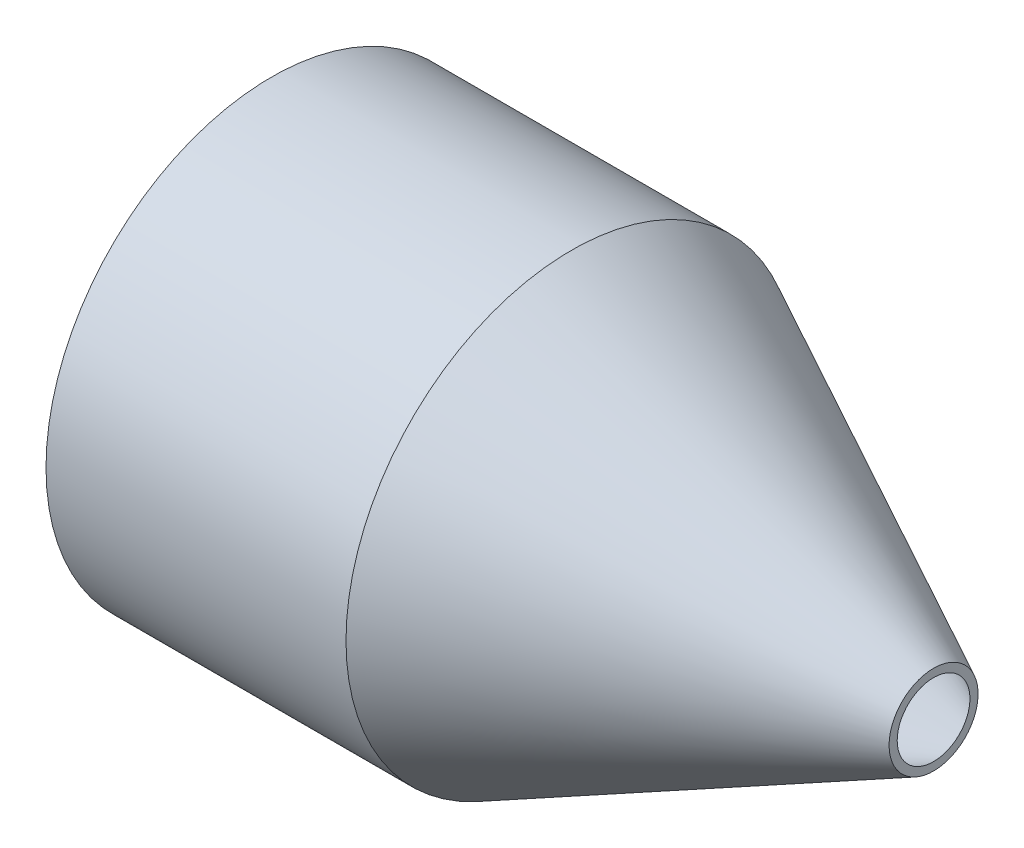
from build123d import *


with BuildPart() as part:
    # Эскиз1 → Повернуть1 (revolve)
    with BuildSketch(Plane.XY, mode=Mode.PRIVATE) as revolve_1_sk:
        Polygon((16.557430953, 300), (416.557430953, 300), (916.557430953, 50), (916.557430953, 61.180339887), (418.918110728, 310), (16.557430953, 310), (6.557430953, 310), (6.557430953, 0), (16.557430953, 0), align=None)
    revolve(revolve_1_sk.sketch.rotate(Axis((0, 0, 0), (-1, 0, 0)), 90), axis=Axis((0, 0, 0), (-1, 0, 0)))


solid = part.part
